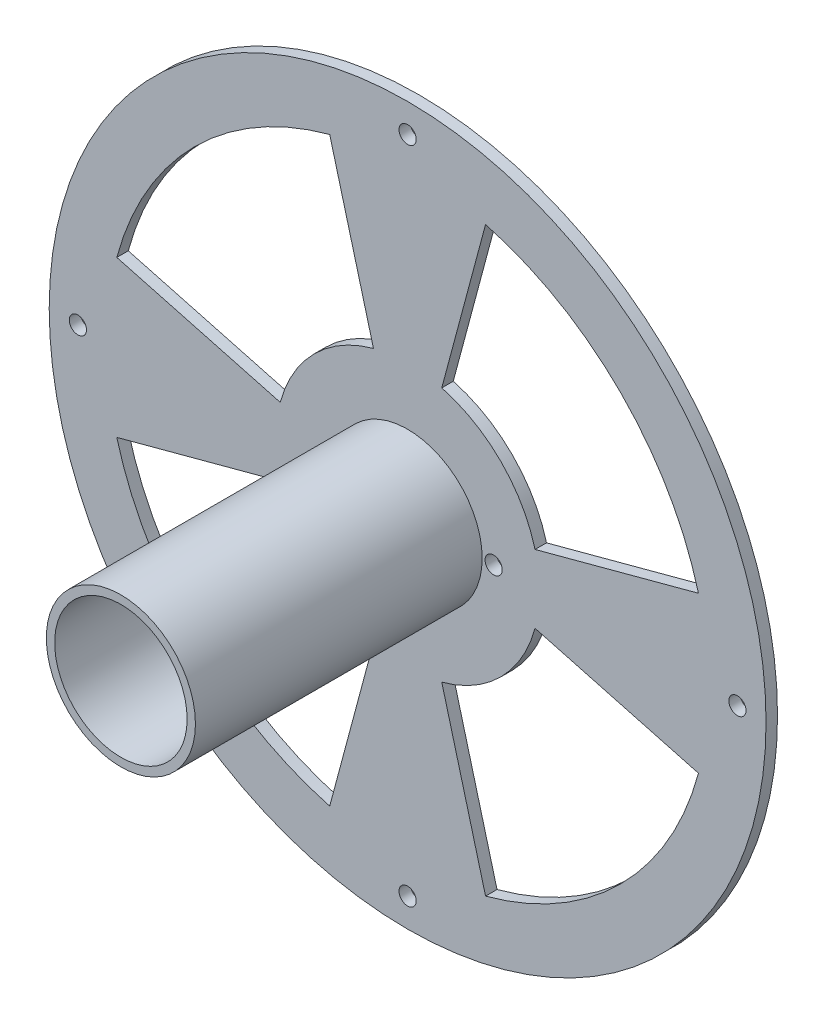
from build123d import *

# Parameters (mm, degrees)
SKETCH1_R           = 62.5
SKETCH1_R_2         = 1.5
BOSS_EXTRUDE1_DEPTH = 2
SKETCH2_R           = 13
BOSS_EXTRUDE2_DEPTH = 50
SKETCH6_R           = 11.55
CUT_EXTRUDE7_DEPTH  = 47
SKETCH7_R           = 10
CUT_EXTRUDE8_DEPTH  = 101.107442281
CUT_EXTRUDE9_DEPTH  = 102.550480058


with BuildPart() as part:
    # Sketch1 → Boss-Extrude1 (new body)
    with BuildSketch(Plane.XY):
        Circle(SKETCH1_R)
        with Locations((-57.5, 0)):
            Circle(SKETCH1_R_2, mode=Mode.SUBTRACT)
        with Locations((0, 57.5)):
            Circle(SKETCH1_R_2, mode=Mode.SUBTRACT)
        with Locations((57.5, 0)):
            Circle(SKETCH1_R_2, mode=Mode.SUBTRACT)
        with Locations((0, -57.5)):
            Circle(SKETCH1_R_2, mode=Mode.SUBTRACT)
        with Locations((-15, 0)):
            Circle(SKETCH1_R_2, mode=Mode.SUBTRACT)
        with Locations(Location((15, 0, 0), (0, 0, 180))):
            Circle(SKETCH1_R_2, mode=Mode.SUBTRACT)
    extrude(amount=BOSS_EXTRUDE1_DEPTH)

    # Sketch2 → Boss-Extrude2 (add)
    with BuildSketch(Plane.XY.offset(2)):
        Circle(SKETCH2_R)
    extrude(amount=BOSS_EXTRUDE2_DEPTH)

    # Sketch6 → Cut-Extrude7 (cut)
    with BuildSketch(Plane.XY.offset(52)):
        Circle(SKETCH6_R)
    extrude(amount=-CUT_EXTRUDE7_DEPTH, mode=Mode.SUBTRACT)

    # Sketch7 → Cut-Extrude8 (cut, through all)
    with BuildSketch(Plane.XY.offset(5)):
        Circle(SKETCH7_R)
    extrude(amount=-CUT_EXTRUDE8_DEPTH, mode=Mode.SUBTRACT)

    # Sector (Cut Extrude) → Cut-Extrude9 (cut, through all)
    with BuildSketch(Plane.XY.offset(2)):
        with BuildLine():
            Line((22.216294005, -5.952838037), (50.71110588, -13.587999868))
            ThreePointArc((50.71110588, -13.587999868), (37.123106012, -37.123106012), (13.587999868, -50.71110588))
            Line((13.587999868, -50.71110588), (5.952838037, -22.216294005))
            ThreePointArc((5.952838037, -22.216294005), (16.263455967, -16.263455967), (22.216294005, -5.952838037))
        make_face()
        with BuildLine():
            Line((-22.216294005, -5.952838037), (-50.71110588, -13.587999868))
            ThreePointArc((-50.71110588, -13.587999868), (-37.123106012, -37.123106012), (-13.587999868, -50.71110588))
            Line((-13.587999868, -50.71110588), (-5.952838037, -22.216294005))
            ThreePointArc((-5.952838037, -22.216294005), (-16.263455967, -16.263455967), (-22.216294005, -5.952838037))
        make_face()
        with BuildLine():
            Line((-5.952838037, 22.216294005), (-13.587999868, 50.71110588))
            ThreePointArc((-13.587999868, 50.71110588), (-37.123106012, 37.123106012), (-50.71110588, 13.587999868))
            Line((-50.71110588, 13.587999868), (-22.216294005, 5.952838037))
            ThreePointArc((-22.216294005, 5.952838037), (-16.263455967, 16.263455967), (-5.952838037, 22.216294005))
        make_face()
        with BuildLine():
            Line((22.216294005, 5.952838037), (50.71110588, 13.587999868))
            ThreePointArc((50.71110588, 13.587999868), (37.123106012, 37.123106012), (13.587999868, 50.71110588))
            Line((13.587999868, 50.71110588), (5.952838037, 22.216294005))
            ThreePointArc((5.952838037, 22.216294005), (16.263455967, 16.263455967), (22.216294005, 5.952838037))
        make_face()
    extrude(amount=-CUT_EXTRUDE9_DEPTH, mode=Mode.SUBTRACT)


solid = part.part
